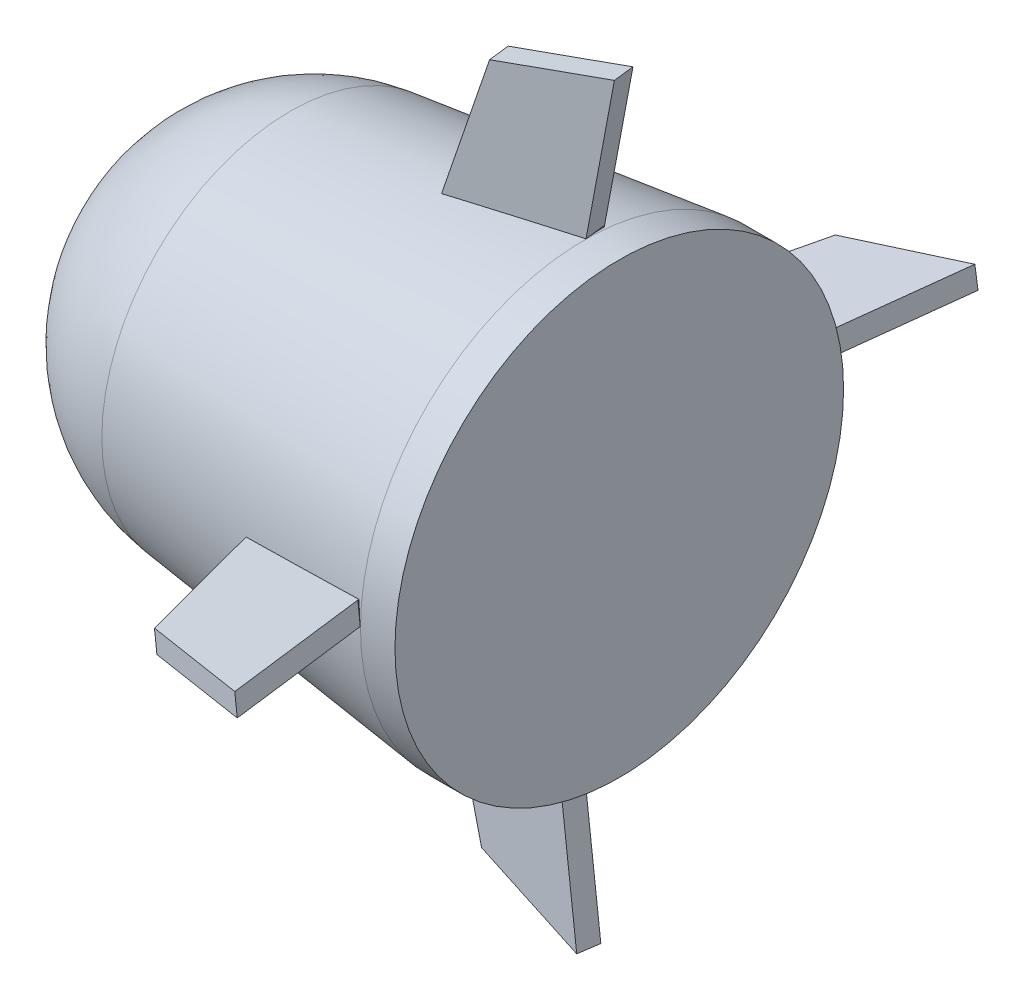
from build123d import *

# Parameters (mm, degrees)
BOSS_EXTRUDE1_DEPTH  = 4
BOSS_EXTRUDE5_DEPTH  = 0.5
CIRPATTERN27_COUNT   = 2
CIRPATTERN28_COUNT   = 2
CIRPATTERN28_ANGLE   = 270
MIRROR5_COPY_1_DEPTH = 4
MIRROR5_COPY_2_DEPTH = 0.5
CUT_EXTRUDE1_DEPTH   = 7.5
CUT_EXTRUDE5_DEPTH   = 7.5
CUT_EXTRUDE8_DEPTH   = 7.5
CUT_EXTRUDE9_DEPTH   = 7.5
SCALE1_SCALE         = 0.78
SKETCH35_R           = 32.4987
BOSS_EXTRUDE6_DEPTH  = 5


with BuildPart() as part:
    # Sketch1 → Revolve1 (revolve)
    with BuildSketch(Plane.XY, mode=Mode.PRIVATE) as revolve1_sk:
        with BuildLine():
            Line((68.355271076, -5.571052632), (68.355271076, 36.093947368))
            Line((68.355271076, 36.093947368), (13.656115926, 29.428947368))
            ThreePointArc((13.656115926, 29.428947368), (-8.192658078, 17.861941693), (-16.644728924, -5.370084567))
            Line((-16.644728924, -5.370084567), (-16.644728924, -5.571052632))
            Line((-16.644728924, -5.571052632), (68.355271076, -5.571052632))
        make_face()
    revolve(revolve1_sk.sketch.rotate(Axis((-16.644728924, -5.571052632, 0), (1, 0, 0)), 90), axis=Axis((-16.644728924, -5.571052632, 0), (1, 0, 0)))



with BuildPart() as body_2:
    # Sketch3 → Boss-Extrude1 (new body)
    with BuildSketch(Plane(origin=(0.689359663, -0.083997315, -5.279598975), x_dir=(0.984180627017453, -0.11992075309071235, 0.13041283058690828), z_dir=(0.12945535873547723, -0.01577391759705046, -0.9914597791228399))):
        Polygon((48.907006258, 38.621427836), (59.41626027, 62.048150042), (80.536298945, 65.037658628), (72.938516553, 38.621427836), align=None)
    boss_extrude1 = extrude(amount=BOSS_EXTRUDE1_DEPTH)


with BuildPart() as part_1:
    add(part.part)

    add(body_2.part)  # Boss-Extrude5 merges body 2
    # Sketch12 → Boss-Extrude5 (add)
    with BuildSketch(Plane(origin=(-4.671405547, -38.337874984, 0), x_dir=(0.9926581468470392, -0.12095372461483828, 0), z_dir=(0.12095372461483828, 0.9926581468470392, 0))):
        Polygon((49.183787896, -1.098502146), (73.010063784, -4.232519427), (73.531715107, -0.266680311), (49.705439218, 2.86733697), align=None)
    boss_extrude5 = extrude(amount=BOSS_EXTRUDE5_DEPTH)

    # CirPattern27: Boss-Extrude1, Boss-Extrude5 ×2 about axis
    cirpattern27_axis = Axis((0, -5.571052632, 0), (1, 0, 0))
    add([boss_extrude1.rotate(cirpattern27_axis, i * 360 / CIRPATTERN27_COUNT) for i in range(1, CIRPATTERN27_COUNT)])
    add([boss_extrude5.rotate(cirpattern27_axis, i * 360 / CIRPATTERN27_COUNT) for i in range(1, CIRPATTERN27_COUNT)])

    # CirPattern28: Boss-Extrude1, Boss-Extrude5 ×2 about axis
    cirpattern28_axis = Axis((0, -5.571052632, 0), (1, 0, 0))
    add([boss_extrude1.rotate(cirpattern28_axis, i * CIRPATTERN28_ANGLE / (CIRPATTERN28_COUNT - 1)) for i in range(1, CIRPATTERN28_COUNT)])
    add([boss_extrude5.rotate(cirpattern28_axis, i * CIRPATTERN28_ANGLE / (CIRPATTERN28_COUNT - 1)) for i in range(1, CIRPATTERN28_COUNT)])

    # Mirror5: Boss-Extrude1, Boss-Extrude5 across plane
    add(boss_extrude1.mirror(Plane.XY))
    add(boss_extrude5.mirror(Plane.XY))

    # Mirror5 copy 1 sketch → Mirror5 copy 1 (add)
    with BuildSketch(Plane(origin=(0.689359663, -10.850651607, 5.487055317), x_dir=(0.984180627017453, 0.13041283058690448, -0.1199207530907165), z_dir=(0.12945535873547723, -0.9914597791228404, -0.01577391759701894))):
        Polygon((48.907006258, -38.621427836), (59.41626027, -62.048150042), (80.536298945, -65.037658628), (72.938516553, -38.621427836), align=None)
    extrude(amount=MIRROR5_COPY_1_DEPTH)

    # Mirror5 copy 2 sketch → Mirror5 copy 2 (add)
    with BuildSketch(Plane(origin=(-4.671405547, -5.571052632, -32.766822353), x_dir=(0.9926581468470392, -3.849360784322416e-15, -0.12095372461483828), z_dir=(0.12095372461483828, 3.155393511496951e-14, 0.9926581468470392))):
        Polygon((49.183787896, 1.098502146), (73.010063784, 4.232519427), (73.531715107, 0.266680311), (49.705439218, -2.86733697), align=None)
    extrude(amount=MIRROR5_COPY_2_DEPTH)

    # Sketch19 → Cut-Extrude1 (cut)
    with BuildSketch(Plane(origin=(1.207181098, -0.147092985, -9.245438092), x_dir=(-0.9915852481222116, -0.002136148499024363, -0.1294377556047779), z_dir=(0.12945535873547703, -0.01577391759705043, -0.99145977912284))):
        Polygon((-67.679175208, -47.235274194), (-71.995880368, -74.381353157), (-48.207029253, -72.13480707), (-43.827344507, -44.302074699), align=None)
    extrude(amount=CUT_EXTRUDE1_DEPTH, mode=Mode.SUBTRACT)

    # Sketch25 → Cut-Extrude5 (cut)
    with BuildSketch(Plane(origin=(0.689359663, -0.083997315, -5.279598975), x_dir=(0.9915852481222117, 0.0021361484990243696, 0.12943775560477816), z_dir=(-0.12945535873547726, 0.015773917597050467, 0.9914597791228399))):
        Polygon((50.891173425, -68.699745189), (71.995880368, -74.381353157), (67.745856954, -47.027055514), (43.827344507, -44.302074699), align=None)
    extrude(amount=CUT_EXTRUDE5_DEPTH, mode=Mode.SUBTRACT)

    # Sketch27 → Cut-Extrude8 (cut)
    with BuildSketch(Plane(origin=(27.301219353, 8.554612251, 3.42863066), x_dir=(-0.1138420069613441, -0.034629872676622354, 0.9928951452038701), z_dir=(-0.9474716659737562, -0.29688244383743123, -0.11898847304688671))):
        Polygon((-1.047061464, -81.100132743), (-2.40192559, -55.459928446), (-6.401425806, -55.574995755), (-5.041488706, -81.311203845), (-3.533903508, -81.231540942), align=None)
    extrude(amount=CUT_EXTRUDE8_DEPTH, mode=Mode.SUBTRACT)

    # Sketch28 → Cut-Extrude9 (cut)
    with BuildSketch(Plane(origin=(-13.685744002, -51.305630722, -0.970692032), x_dir=(-0.9662265281220836, 0.25764897067882825, 0.00482744873453606), z_dir=(-0.25769418750233414, -0.9660536410379842, -0.018277537163565623))):
        Polygon((-89.283438439, -2.656910088), (-88.769166907, -6.623772053), (-66.015638627, -3.548604791), (-66.551372854, 0.415356464), align=None)
    extrude(amount=CUT_EXTRUDE9_DEPTH, mode=Mode.SUBTRACT)


with BuildPart() as part_2:
    # Scale1: scaled about (34.142034643, -5.554496793, -1.7178e-05)
    add(part_1.part.scale(SCALE1_SCALE).moved(Location((7.511247621, -1.221989294, -3.779e-06))))

    # Sketch35 → Boss-Extrude6 (add)
    with BuildSketch(Plane(origin=(60.828359062, 0, 0), x_dir=(0, 0, -1), z_dir=(1, 0, 0))):
        with Locations((3.778e-06, -5.567410349)):
            Circle(SKETCH35_R)
    extrude(amount=BOSS_EXTRUDE6_DEPTH)


solid = part_2.part
